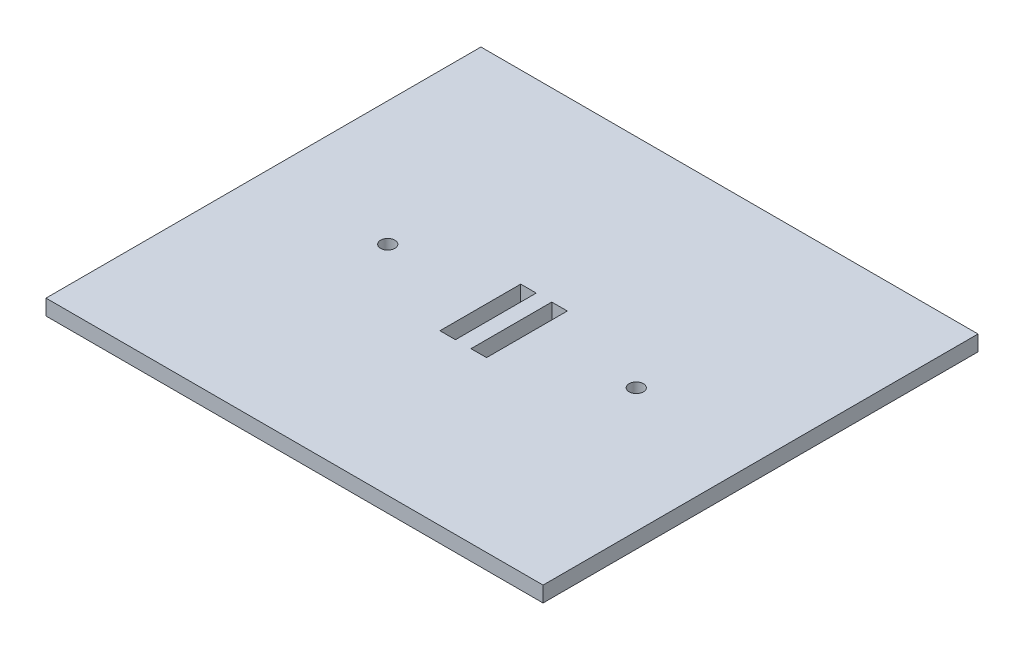
from build123d import *

# Parameters (mm, degrees)
SKETCH2_W           = 101.6
SKETCH2_H           = 88.9
BOSS_EXTRUDE1_DEPTH = 3.175
SKETCH3_R           = 1.4605
CUT_EXTRUDE1_DEPTH  = 68.576054376
SKETCH5_W           = 3.175
SKETCH5_H           = 16.51
CUT_EXTRUDE2_DEPTH  = 68.576054376


with BuildPart() as part:
    # Sketch2 → Boss-Extrude1 (new body)
    with BuildSketch(Plane(origin=(0, 0, 0), x_dir=(1, 0, 0), z_dir=(0, 1, 0))):
        Rectangle(SKETCH2_W, SKETCH2_H)
    extrude(amount=BOSS_EXTRUDE1_DEPTH)

    # Sketch3 → Cut-Extrude1 (cut, through all)
    with BuildSketch(Plane(origin=(0, 3.175, 0), x_dir=(1, 0, 0), z_dir=(0, 1, 0))):
        with Locations(Location((-25.4, 0, 0), (0, 0, 270))):
            Circle(SKETCH3_R)
        with Locations(Location((25.4, 0, 0), (0, 0, 270))):
            Circle(SKETCH3_R)
    extrude(amount=-CUT_EXTRUDE1_DEPTH, mode=Mode.SUBTRACT)

    # Sketch5 → Cut-Extrude2 (cut, through all)
    with BuildSketch(Plane(origin=(0, 3.175, 0), x_dir=(1, 0, 0), z_dir=(0, 1, 0))):
        with Locations((-3.175, -1.713817512)):
            Rectangle(SKETCH5_W, SKETCH5_H)
        with Locations((3.175, -1.713817512)):
            Rectangle(SKETCH5_W, SKETCH5_H)
    extrude(amount=-CUT_EXTRUDE2_DEPTH, mode=Mode.SUBTRACT)


solid = part.part
